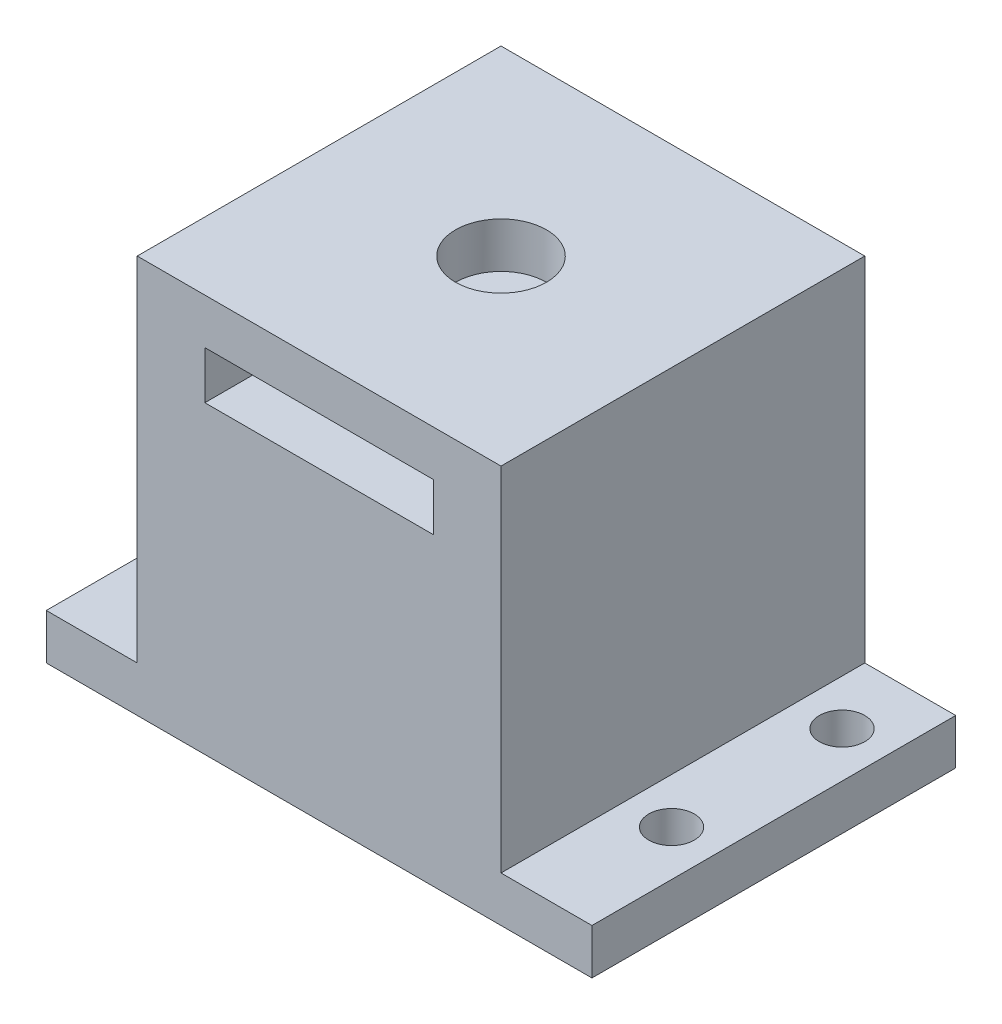
from build123d import *

# Parameters (mm, degrees)
SKETCH1_W           = 32
SKETCH1_H           = 32
BOSS_EXTRUDE1_DEPTH = 35
SKETCH2_W           = 8
SKETCH2_H           = 32
SKETCH2_R           = 2
BOSS_EXTRUDE2_DEPTH = 4
CUT_EXTRUDE1_REACH  = 55.151
SKETCH4_W           = 20.1
SKETCH4_H           = 4.2
CUT_EXTRUDE2_REACH  = 47.354
SKETCH5_R           = 4


with BuildPart() as part:
    # Sketch1 → Boss-Extrude1 (new body)
    with BuildSketch(Plane(origin=(0, 0, 0), x_dir=(1, 0, 0), z_dir=(0, 1, 0))):
        Rectangle(SKETCH1_W, SKETCH1_H)
    extrude(amount=BOSS_EXTRUDE1_DEPTH)

    # Sketch2 → Boss-Extrude2 (add)
    with BuildSketch(Plane.XZ):
        with Locations((-20, 0)):
            Rectangle(SKETCH2_W, SKETCH2_H)
        with Locations(Location((-20, 5, 0), (0, 0, 270))):
            Circle(SKETCH2_R, mode=Mode.SUBTRACT)
        with Locations(Location((-20, -10, 0), (0, 0, 270))):
            Circle(SKETCH2_R, mode=Mode.SUBTRACT)
    boss_extrude2 = extrude(amount=-BOSS_EXTRUDE2_DEPTH)

    # Mirror1: Boss-Extrude2 across plane
    add(boss_extrude2.mirror(Plane(origin=(0, 0, 0), x_dir=(0, 0, 1), z_dir=(1, 0, 0))))

    # Sketch4 → Cut-Extrude1 (cut, up to next)
    with BuildSketch(Plane(origin=(0, 0, -16), x_dir=(-1, 0, 0), z_dir=(0, 0, -1)), mode=Mode.PRIVATE) as cut_extrude1_sk1:
        with Locations((0, 28.9)):
            Rectangle(SKETCH4_W, SKETCH4_H)
    cut_extrude1_tool1 = extrude(cut_extrude1_sk1.sketch, amount=-CUT_EXTRUDE1_REACH, mode=Mode.PRIVATE) & part.part
    add(cut_extrude1_tool1.solids().sort_by_distance((0, 28.9, -16))[0], mode=Mode.SUBTRACT)

    # Sketch5 → Cut-Extrude2 (cut, up to next)
    with BuildSketch(Plane(origin=(0, 35, 0), x_dir=(1, 0, 0), z_dir=(0, 1, 0)), mode=Mode.PRIVATE) as cut_extrude2_sk1:
        with Locations(Location((0, 0, 0), (0, 0, 270))):
            Circle(SKETCH5_R)
    cut_extrude2_tool1 = extrude(cut_extrude2_sk1.sketch, amount=-CUT_EXTRUDE2_REACH, mode=Mode.PRIVATE) & part.part
    add(cut_extrude2_tool1.solids().sort_by_distance((0, 35, 0))[0], mode=Mode.SUBTRACT)


solid = part.part
